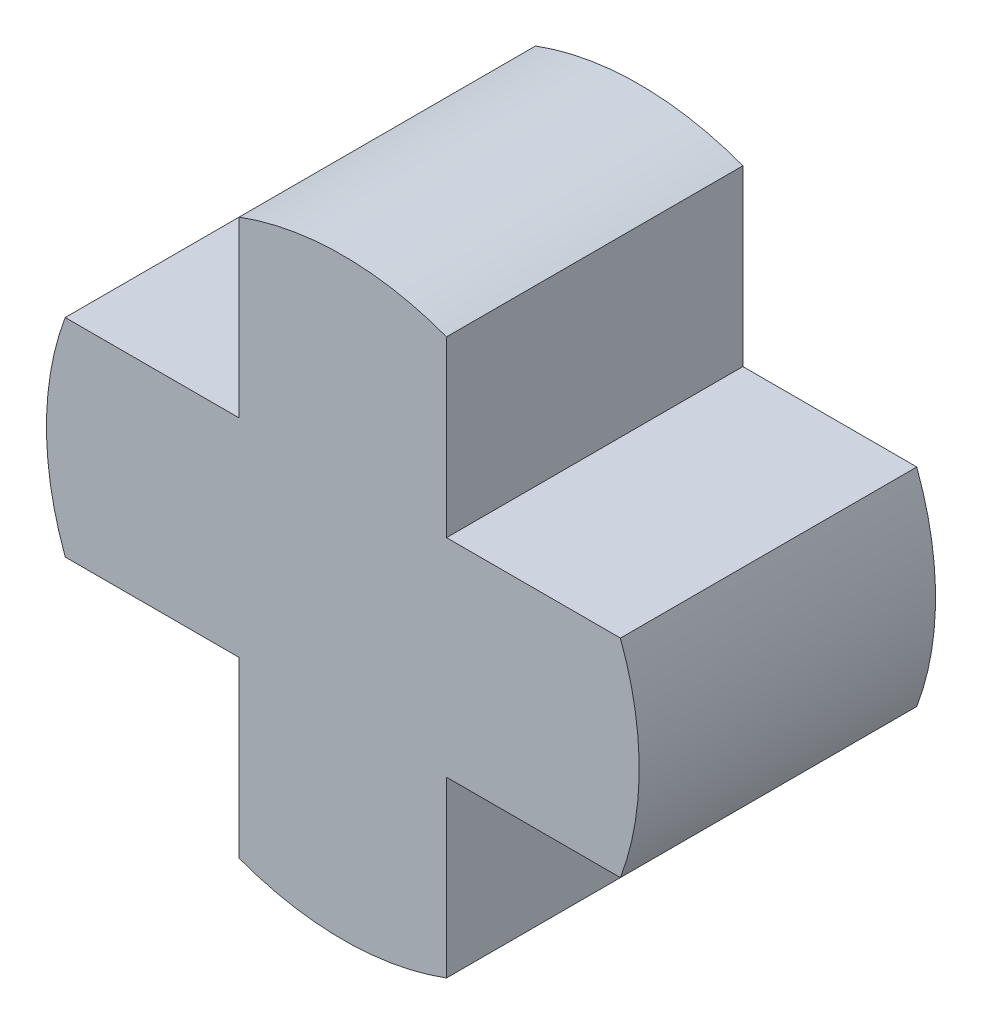
from build123d import *

# Parameters (mm, degrees)
SKETCH_1_W      = 7
SKETCH_1_H      = 7
EXTRUDE_1_DEPTH = 10


with BuildPart() as part:
    # 스케치1 → 보스-돌출1 (new body)
    with BuildSketch(Plane.XY):
        with BuildLine():
            Line((-3.5, 3.5), (3.5, 3.5))
            Line((3.5, 3.5), (3.5, 9.367496998))
            ThreePointArc((3.5, 9.367496998), (0, 10), (-3.5, 9.367496998))
            Line((-3.5, 9.367496998), (-3.5, 3.5))
        make_face()
        with BuildLine():
            Line((-9.367496998, -3.5), (-3.5, -3.5))
            Line((-3.5, -3.5), (-3.5, 3.5))
            Line((-3.5, 3.5), (-9.367496998, 3.5))
            ThreePointArc((-9.367496998, 3.5), (-10, 0), (-9.367496998, -3.5))
        make_face()
        Rectangle(SKETCH_1_W, SKETCH_1_H)
        with BuildLine():
            ThreePointArc((-3.5, -9.367496998), (-1.778346145, -9.840603893), (0, -10))
            ThreePointArc((0, -10), (1.778346145, -9.840603893), (3.5, -9.367496998))
            Line((3.5, -9.367496998), (3.5, -3.5))
            Line((3.5, -3.5), (-3.5, -3.5))
            Line((-3.5, -3.5), (-3.5, -9.367496998))
        make_face()
        with BuildLine():
            Line((3.5, 3.5), (3.5, -3.5))
            Line((3.5, -3.5), (9.367496998, -3.5))
            ThreePointArc((9.367496998, -3.5), (9.840603893, -1.778346145), (10, 0))
            ThreePointArc((10, 0), (9.840603893, 1.778346145), (9.367496998, 3.5))
            Line((9.367496998, 3.5), (3.5, 3.5))
        make_face()
    extrude(amount=EXTRUDE_1_DEPTH)


solid = part.part
